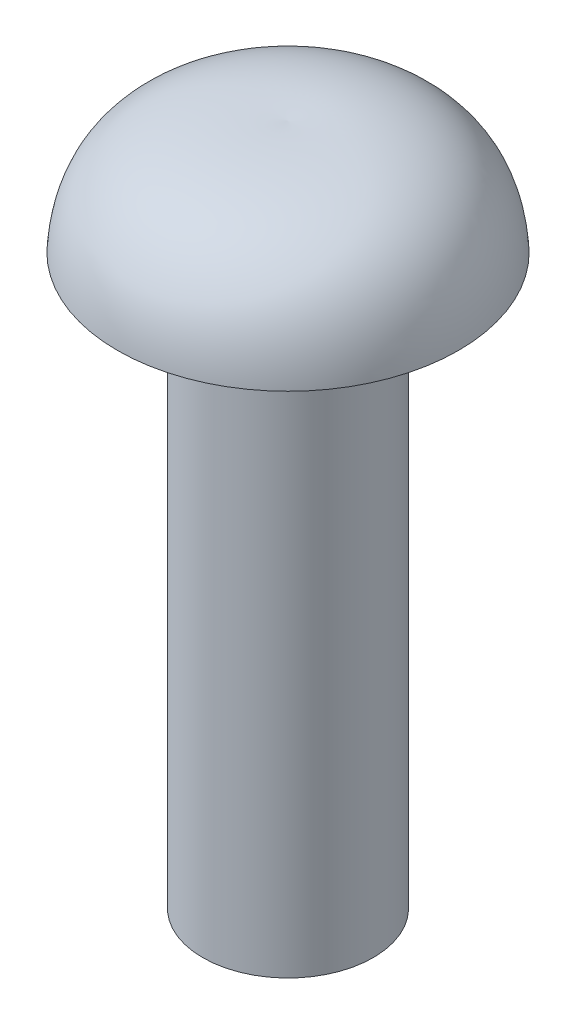
from build123d import *

# Parameters (mm, degrees)
SKETCH_2_R      = 1.5
EXTRUDE_1_DEPTH = 10


with BuildPart() as part:
    # ｽｹｯﾁ2 → ﾎﾞｽ - 押し出し1 (new body)
    with BuildSketch(Plane(origin=(0, 0, 0), x_dir=(1, 0, 0), z_dir=(0, 1, 0))):
        with Locations(Location((0, 0, 0), (0, 0, 270))):
            Circle(SKETCH_2_R)
    extrude(amount=EXTRUDE_1_DEPTH)

    # ｽｹｯﾁ4 → 回転1 (revolve)
    with BuildSketch(Plane.XY):
        with BuildLine():
            Line((0, 10), (3, 10))
            add(Edge.make_bspline(
                [(0, 12), (2.850923329, 12.199757549), (3, 10)],
                knots=[0, 0, 0, 1, 1, 1], degree=2))
            Line((0, 12), (0, 10))
        make_face()
    revolve(axis=Axis((0, 10, 0), (0, -1, 0)))


solid = part.part
